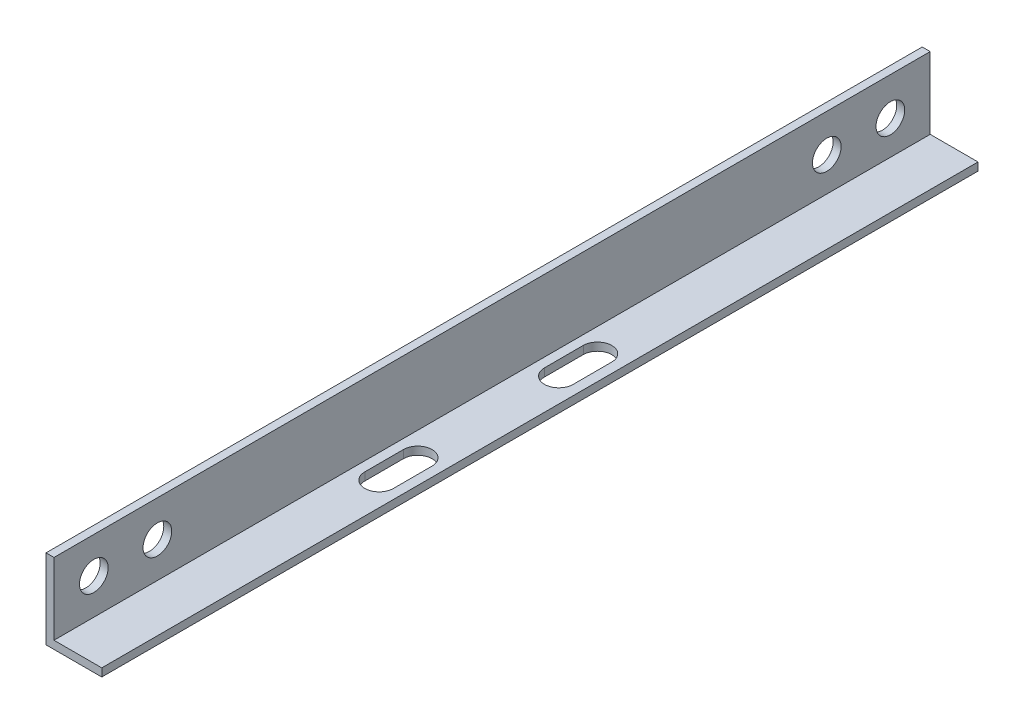
from build123d import *

# Parameters (mm, degrees)
BOSS_EXTRUDE1_DEPTH = 549.91
SKETCH2_R           = 9
CUT_EXTRUDE1_DEPTH  = 10
CUT_EXTRUDE2_DEPTH  = 10


with BuildPart() as part:
    # Sketch1 → Boss-Extrude1 (new body)
    with BuildSketch(Plane.XY):
        Polygon((-9.285714286, 23.80952381), (-9.285714286, -26.19047619), (25.714285714, -26.19047619), (25.714285714, -21.19047619), (-4.285714286, -21.19047619), (-4.285714286, 23.80952381), align=None)
    extrude(amount=BOSS_EXTRUDE1_DEPTH)

    # Sketch2 → Cut-Extrude1 (cut)
    with BuildSketch(Plane(origin=(-4.285714286, 0, 0), x_dir=(0, 0, -1), z_dir=(1, 0, 0))):
        with Locations(Location((-524.91, 1.249990258, 0), (0, 0, 90))):
            Circle(SKETCH2_R)
        with Locations(Location((-485, 1.154950897, 0), (0, 0, 90))):
            Circle(SKETCH2_R)
        with Locations(Location((-64.91, 0.154572913, 0), (0, 0, 90))):
            Circle(SKETCH2_R)
        with Locations(Location((-25, 0.059533551, 0), (0, 0, 90))):
            Circle(SKETCH2_R)
    extrude(amount=-CUT_EXTRUDE1_DEPTH, mode=Mode.SUBTRACT)

    # Sketch3 → Cut-Extrude2 (cut)
    with BuildSketch(Plane(origin=(0, -21.19047619, 0), x_dir=(1, 0, 0), z_dir=(0, 1, 0))):
        with BuildLine():
            Line((1.733492456, -360.884266397), (1.697419827, -336.465805265))
            ThreePointArc((1.697419827, -336.465805265), (10.6962494, -327.610947677), (19.695078973, -336.465805265))
            Line((19.695078973, -336.465805265), (19.733492456, -360.884266397))
            ThreePointArc((19.733492456, -360.884266397), (10.733492456, -369.884266397), (1.733492456, -360.884266397))
        make_face()
        with BuildLine():
            Line((1.582473361, -247.923607511), (1.546400733, -223.505146379))
            ThreePointArc((1.546400733, -223.505146379), (10.545230305, -214.650288791), (19.544059878, -223.505146379))
            Line((19.544059878, -223.505146379), (19.582473361, -247.923607511))
            ThreePointArc((19.582473361, -247.923607511), (10.582473361, -256.923607511), (1.582473361, -247.923607511))
        make_face()
    extrude(amount=-CUT_EXTRUDE2_DEPTH, mode=Mode.SUBTRACT)


solid = part.part
